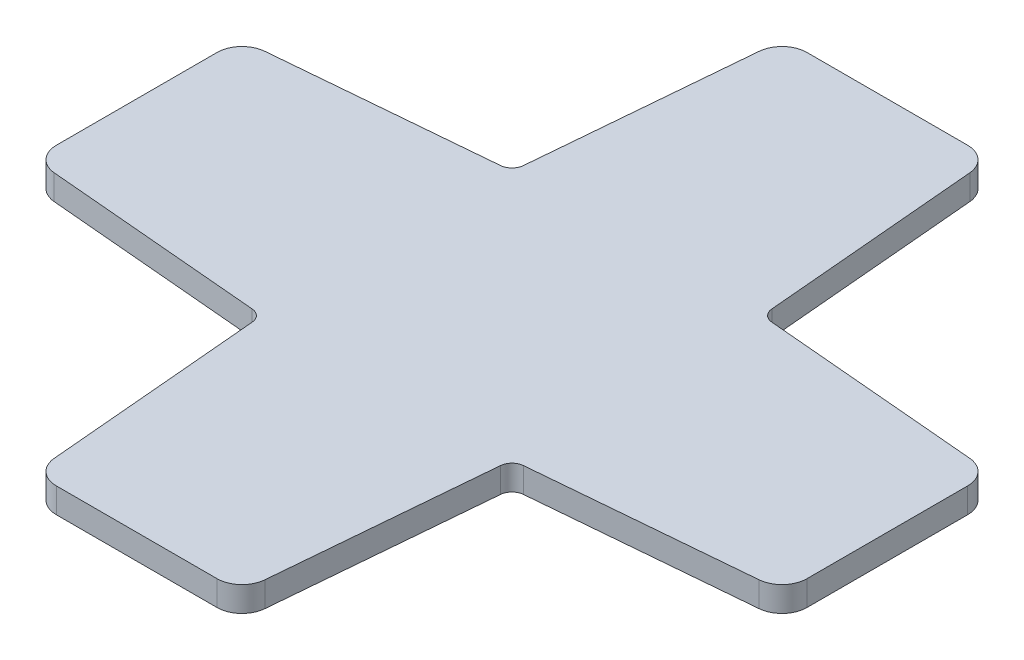
from build123d import *

# Parameters (mm, degrees)
BOSS_EXTRUDE1_DEPTH = 3


with BuildPart() as part:
    # Sketch1 → Boss-Extrude1 (new body)
    with BuildSketch(Plane(origin=(0, 0, 0), x_dir=(1, 0, 0), z_dir=(0, 1, 0))):
        with BuildLine():
            Line((-14.890188717, 16.254064822), (-12.620010218, 42.260882944))
            ThreePointArc((-12.620010218, 42.260882944), (-11.658361887, 44.211633879), (-9.631375063, 45))
            Line((-9.631375063, 45), (9.631375063, 45))
            ThreePointArc((9.631375063, 45), (11.658361887, 44.211633879), (12.620010218, 42.260882944))
            Line((12.620010218, 42.260882944), (14.890188717, 16.254064822))
            ThreePointArc((14.890188717, 16.254064822), (15.323846122, 15.323846122), (16.254064822, 14.890188717))
            Line((16.254064822, 14.890188717), (42.260882944, 12.620010218))
            ThreePointArc((42.260882944, 12.620010218), (44.211633879, 11.658361887), (45, 9.631375063))
            Line((45, 9.631375063), (45, -9.631375063))
            ThreePointArc((45, -9.631375063), (44.211633879, -11.658361887), (42.260882944, -12.620010218))
            Line((42.260882944, -12.620010218), (16.254064822, -14.890188717))
            ThreePointArc((16.254064822, -14.890188717), (15.323846122, -15.323846122), (14.890188717, -16.254064822))
            Line((14.890188717, -16.254064822), (12.620010218, -42.260882944))
            ThreePointArc((12.620010218, -42.260882944), (11.658361887, -44.211633879), (9.631375063, -45))
            Line((9.631375063, -45), (-9.631375063, -45))
            ThreePointArc((-9.631375063, -45), (-11.658361887, -44.211633879), (-12.620010218, -42.260882944))
            Line((-12.620010218, -42.260882944), (-14.890188717, -16.254064822))
            ThreePointArc((-14.890188717, -16.254064822), (-15.323846122, -15.323846122), (-16.254064822, -14.890188717))
            Line((-16.254064822, -14.890188717), (-42.260882944, -12.620010218))
            ThreePointArc((-42.260882944, -12.620010218), (-44.211633879, -11.658361887), (-45, -9.631375063))
            Line((-45, -9.631375063), (-45, 9.631375063))
            ThreePointArc((-45, 9.631375063), (-44.211633879, 11.658361887), (-42.260882944, 12.620010218))
            Line((-42.260882944, 12.620010218), (-16.254064822, 14.890188717))
            ThreePointArc((-16.254064822, 14.890188717), (-15.323846122, 15.323846122), (-14.890188717, 16.254064822))
        make_face()
    extrude(amount=BOSS_EXTRUDE1_DEPTH)


solid = part.part
